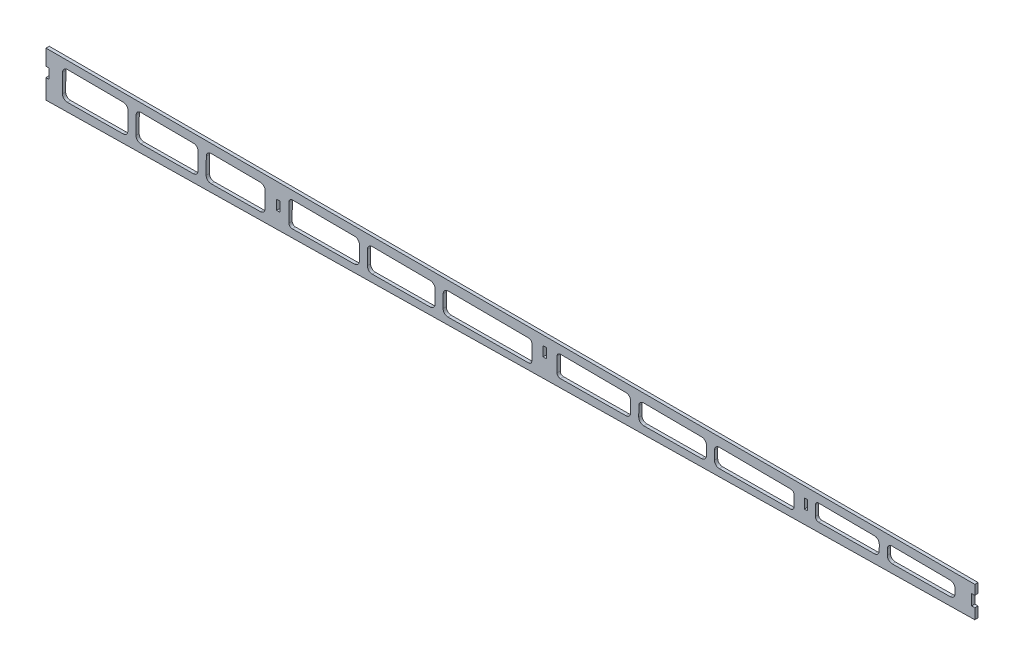
from build123d import *

# Parameters (mm, degrees)
MODEL_W         = 2
MODEL_H         = 6
EXTRUDE_1_DEPTH = 2


with BuildPart() as part:
    # Model → 凸台-拉伸1 (new body)
    with BuildSketch(Plane.XY):
        Polygon((586.216263019, 41.768412003), (586.216263019, 35.855412003), (584.216263019, 35.855412003), (584.216263019, 29.154912003), (586.216263019, 29.154912003), (586.216263019, 22.750482518), (10.971476696, 13.842211299), (10.971476696, 25.978012003), (12.971476696, 25.978012003), (12.971476696, 32.006812003), (10.971476696, 32.006812003), (10.971476696, 41.768412003), (154.87521024, 41.768412003), (317.652575925, 41.768412003), (481.210656258, 41.768412003), align=None)
        with Locations((154.779030244, 29.144412003)):
            Rectangle(MODEL_W, MODEL_H, mode=Mode.SUBTRACT)
        Polygon((318.855190189, 33.150012003), (318.855190189, 30.095512003), (320.855190189, 30.095512003), (320.855190189, 36.095512003), (318.855190189, 36.095512003), align=None, mode=Mode.SUBTRACT)
        Polygon((480.71418574, 34.458512003), (480.71418574, 29.376512003), (482.71418574, 29.376512003), (482.71418574, 35.376512003), (480.71418574, 35.376512003), align=None, mode=Mode.SUBTRACT)
        with BuildLine():
            Line((58.757152566, 36.70165117), (24.257789514, 36.910650883))
            ThreePointArc((24.257789514, 36.910650883), (22.131185086, 36.044838231), (21.239670672, 33.928879822))
            Line((21.239670672, 33.928879822), (21.16943188, 22.334636165))
            ThreePointArc((21.16943188, 22.334636165), (22.051503861, 20.191700151), (24.197293169, 19.316592165))
            Line((24.197293169, 19.316592165), (58.699867458, 19.637667912))
            ThreePointArc((58.699867458, 19.637667912), (60.796713244, 20.519665053), (61.671896071, 22.619364132))
            Line((61.671896071, 22.619364132), (61.738923627, 33.683532329))
            ThreePointArc((61.738923627, 33.683532329), (60.873110975, 35.810136756), (58.757152566, 36.70165117))
        make_face(mode=Mode.SUBTRACT)
        with BuildLine():
            Line((146.748077677, 33.168540536), (146.688962862, 23.41052012))
            ThreePointArc((146.688962862, 23.41052012), (145.813780035, 21.310821041), (143.716934249, 20.4288239))
            Line((143.716934249, 20.4288239), (113.202550526, 20.144861652))
            ThreePointArc((113.202550526, 20.144861652), (111.056761218, 21.019969638), (110.174689236, 23.162905652))
            Line((110.174689236, 23.162905652), (110.236644098, 33.389729523))
            ThreePointArc((110.236644098, 33.389729523), (111.128158512, 35.505687932), (113.254762939, 36.371500584))
            Line((113.254762939, 36.371500584), (143.766306616, 36.186659378))
            ThreePointArc((143.766306616, 36.186659378), (145.882265025, 35.295144964), (146.748077677, 33.168540536))
        make_face(mode=Mode.SUBTRACT)
        with BuildLine():
            Line((69.756360643, 36.635017148), (102.25576428, 36.438133338))
            ThreePointArc((102.25576428, 36.438133338), (104.371722689, 35.546618924), (105.237535341, 33.420014496))
            Line((105.237535341, 33.420014496), (105.174556682, 23.024193324))
            ThreePointArc((105.174556682, 23.024193324), (104.299373855, 20.924494244), (102.202528069, 20.042497104))
            Line((102.202528069, 20.042497104), (69.700099353, 19.740034409))
            ThreePointArc((69.700099353, 19.740034409), (67.554310045, 20.615142396), (66.672238064, 22.75807841))
            Line((66.672238064, 22.75807841), (66.738241802, 33.653246087))
            ThreePointArc((66.738241802, 33.653246087), (67.629756216, 35.769204496), (69.756360643, 36.635017148))
        make_face(mode=Mode.SUBTRACT)
        with BuildLine():
            Line((163.541092581, 36.647103391), (202.093717488, 36.421153648))
            ThreePointArc((202.093717488, 36.421153648), (204.20886557, 35.527718408), (205.072747005, 33.400328739))
            Line((205.072747005, 33.400328739), (205.010197063, 24.421095996))
            ThreePointArc((205.010197063, 24.421095996), (204.134099679, 22.323185807), (202.038269411, 21.442124358))
            Line((202.038269411, 21.442124358), (163.465475762, 21.112553873))
            ThreePointArc((163.465475762, 21.112553873), (162.034270797, 21.69658021), (161.446857912, 23.12639856))
            Line((161.446857912, 23.12639856), (161.527209308, 34.661083712))
            ThreePointArc((161.527209308, 34.661083712), (162.122832802, 36.071182434), (163.541092581, 36.647103391))
        make_face(mode=Mode.SUBTRACT)
        with BuildLine():
            Line((213.082693343, 36.344603699), (248.994694933, 36.094438268))
            ThreePointArc((248.994694933, 36.094438268), (251.109843016, 35.201003028), (251.973724451, 33.073613359))
            Line((251.973724451, 33.073613359), (251.916500205, 24.858900378))
            ThreePointArc((251.916500205, 24.858900378), (251.040402821, 22.760990189), (248.944572553, 21.87992874))
            Line((248.944572553, 21.87992874), (213.036483972, 21.544777225))
            ThreePointArc((213.036483972, 21.544777225), (210.890640913, 22.419855058), (210.008539459, 24.56282045))
            Line((210.008539459, 24.56282045), (210.061850696, 33.362850376))
            ThreePointArc((210.061850696, 33.362850376), (210.954334175, 35.479765744), (213.082693343, 36.344603699))
        make_face(mode=Mode.SUBTRACT)
        with BuildLine():
            Line((259.984364938, 36.017883484), (309.946986323, 35.73855234))
            ThreePointArc((309.946986323, 35.73855234), (311.357085044, 35.142928847), (311.933006001, 33.724669067))
            Line((311.933006001, 33.724669067), (311.867917884, 24.38107371))
            ThreePointArc((311.867917884, 24.38107371), (311.289568546, 22.971847644), (309.886518402, 22.378672834))
            Line((309.886518402, 22.378672834), (259.93857923, 21.982545284))
            ThreePointArc((259.93857923, 21.982545284), (257.795454375, 22.859145292), (256.914842601, 25.000624832))
            Line((256.914842601, 25.000624832), (256.963522291, 33.03613016))
            ThreePointArc((256.963522291, 33.03613016), (257.85600577, 35.153045529), (259.984364938, 36.017883484))
        make_face(mode=Mode.SUBTRACT)
        with BuildLine():
            Line((329.559168481, 36.86823931), (370.143868366, 36.585523546))
            ThreePointArc((370.143868366, 36.585523546), (372.258059929, 35.693057805), (373.122915621, 33.567422443))
            Line((373.122915621, 33.567422443), (373.084136783, 27.166240277))
            ThreePointArc((373.084136783, 27.166240277), (372.209502307, 25.067091475), (370.113661797, 24.184558917))
            Line((370.113661797, 24.184558917), (329.500631729, 23.7855848))
            ThreePointArc((329.500631729, 23.7855848), (328.069426764, 24.369611137), (327.482013878, 25.799429487))
            Line((327.482013878, 25.799429487), (327.545285209, 34.882219631))
            ThreePointArc((327.545285209, 34.882219631), (328.140908702, 36.292318353), (329.559168481, 36.86823931))
        make_face(mode=Mode.SUBTRACT)
        with BuildLine():
            Line((381.143677955, 36.508898129), (417.045539961, 36.258803331))
            ThreePointArc((417.045539961, 36.258803331), (419.159731524, 35.36633759), (420.024587216, 33.240702227))
            Line((420.024587216, 33.240702227), (419.990439925, 27.604044659))
            ThreePointArc((419.990439925, 27.604044659), (419.115286475, 25.504375053), (417.018494535, 24.622349215))
            Line((417.018494535, 24.622349215), (381.113087215, 24.287222726))
            ThreePointArc((381.113087215, 24.287222726), (378.967244157, 25.162300559), (378.085142702, 27.305265951))
            Line((378.085142702, 27.305265951), (378.122835308, 33.527144806))
            ThreePointArc((378.122835308, 33.527144806), (379.015318787, 35.644060174), (381.143677955, 36.508898129))
        make_face(mode=Mode.SUBTRACT)
        with BuildLine():
            Line((428.04534955, 36.182177913), (472.3342856, 35.87365819))
            ThreePointArc((472.3342856, 35.87365819), (473.744384321, 35.278034697), (474.320305278, 33.859774917))
            Line((474.320305278, 33.859774917), (474.273385029, 27.12423169))
            ThreePointArc((474.273385029, 27.12423169), (473.689320106, 25.725624897), (472.292099928, 25.138250597))
            Line((472.292099928, 25.138250597), (428.019390357, 24.725027108))
            ThreePointArc((428.019390357, 24.725027108), (425.873547299, 25.600104941), (424.991445844, 27.743070333))
            Line((424.991445844, 27.743070333), (425.024506903, 33.20042459))
            ThreePointArc((425.024506903, 33.20042459), (425.916990382, 35.317339958), (428.04534955, 36.182177913))
        make_face(mode=Mode.SUBTRACT)
        with BuildLine():
            Line((489.48114747, 36.970903278), (524.086911809, 36.729837184))
            ThreePointArc((524.086911809, 36.729837184), (526.202059891, 35.836401944), (527.065941326, 33.709012275))
            Line((527.065941326, 33.709012275), (527.040585105, 30.069050249))
            ThreePointArc((527.040585105, 30.069050249), (526.164487721, 27.97114006), (524.068657453, 27.09007861))
            Line((524.068657453, 27.09007861), (489.48114747, 26.76725284))
            ThreePointArc((489.48114747, 26.76725284), (488.054336113, 27.346909518), (487.462481687, 28.768704459))
            Line((487.462481687, 28.768704459), (487.467264197, 34.9848836))
            ThreePointArc((487.467264197, 34.9848836), (488.062887691, 36.394982321), (489.48114747, 36.970903278))
        make_face(mode=Mode.SUBTRACT)
        with BuildLine():
            Line((535.08073548, 36.653253465), (570.987889254, 36.403121804))
            ThreePointArc((570.987889254, 36.403121804), (573.103037337, 35.509686564), (573.966918772, 33.382296895))
            Line((573.966918772, 33.382296895), (573.946888247, 30.506854631))
            ThreePointArc((573.946888247, 30.506854631), (573.070790863, 28.408944442), (570.974960595, 27.527882992))
            Line((570.974960595, 27.527882992), (535.066872014, 27.192731478))
            ThreePointArc((535.066872014, 27.192731478), (532.921028955, 28.067809311), (532.038927501, 30.210774703))
            Line((532.038927501, 30.210774703), (532.059892833, 33.671500141))
            ThreePointArc((532.059892833, 33.671500141), (532.952376312, 35.78841551), (535.08073548, 36.653253465))
        make_face(mode=Mode.SUBTRACT)
    extrude(amount=EXTRUDE_1_DEPTH)


solid = part.part
